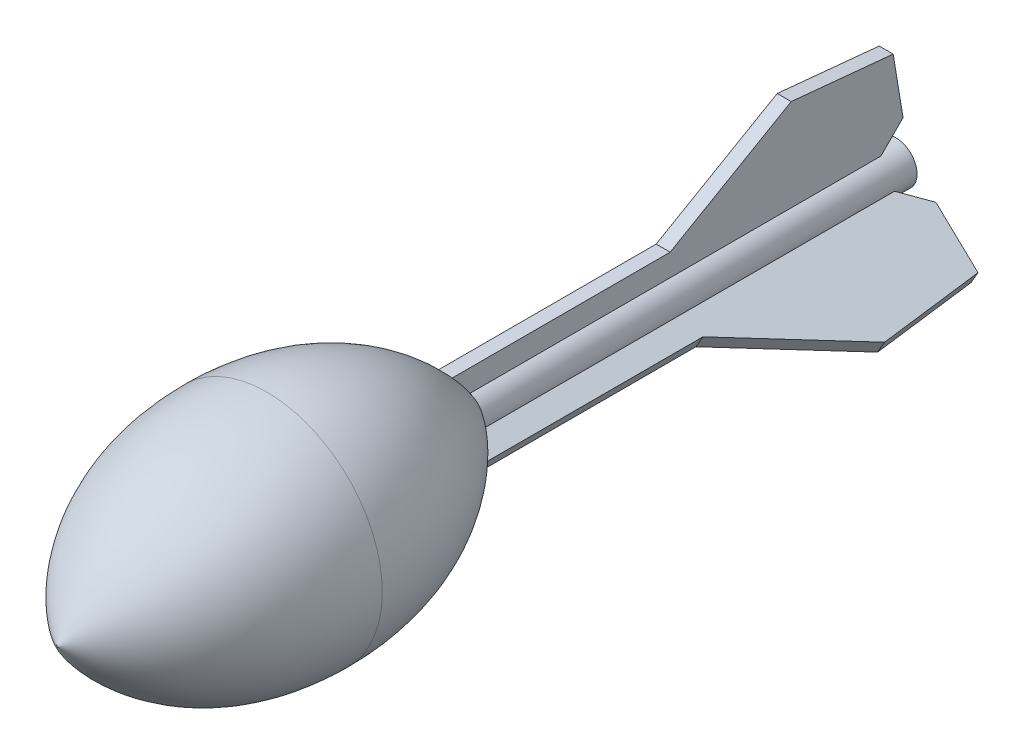
from build123d import *

# Parameters (mm, degrees)
BOSS_EXTRUDE1_DEPTH = 2.5
CIRPATTERN2_COUNT   = 3


with BuildPart() as part:
    # Sketch1 → Revolve1 (revolve)
    with BuildSketch(Plane(origin=(0, 0, 0), x_dir=(0, 0, -1), z_dir=(1, 0, 0)), mode=Mode.PRIVATE) as revolve1_sk:
        with BuildLine():
            Line((225, 0), (225, 7.5))
            Line((225, 7.5), (70.12061166, 7.5))
            add(Edge.make_bspline(
                [(70.12061166, 7.5), (56.641182796, 25.980733589), (33.840993592, 41.275), (0, 41.275)],
                knots=[0.117191472, 0.117191472, 0.117191472, 0.117191472, 1, 1, 1, 1], degree=3))
            add(Edge.make_bspline(
                [(-75, 0), (-62.5, 21.650635095), (-38.333333333, 41.275), (0, 41.275)],
                knots=[0, 0, 0, 0, 1, 1, 1, 1], degree=3))
            Line((-75, 0), (225, 0))
        make_face()
    revolve(revolve1_sk.sketch.rotate(Axis((0, 0, 75), (0, 0, -1)), 180), axis=Axis((0, 0, 75), (0, 0, -1)))

    # Sketch2 → Boss-Extrude1 (add, symmetric)
    with BuildSketch(Plane(origin=(0, 0, 0), x_dir=(0, 0, -1), z_dir=(1, 0, 0))):
        Polygon((185, 40), (141.698729811, 15), (52.71703536, 15), (52.71703536, 0), (210, 0), (225, 15), (221.464466094, 36.464466094), align=None)
    boss_extrude1 = extrude(amount=BOSS_EXTRUDE1_DEPTH, both=True)

    # CirPattern2: Boss-Extrude1 ×3 about axis
    cirpattern2_axis = Axis((0, 0, 0), (0, 0, 1))
    for i in range(1, CIRPATTERN2_COUNT):
        add(boss_extrude1.rotate(cirpattern2_axis, i * 360 / CIRPATTERN2_COUNT))


solid = part.part
